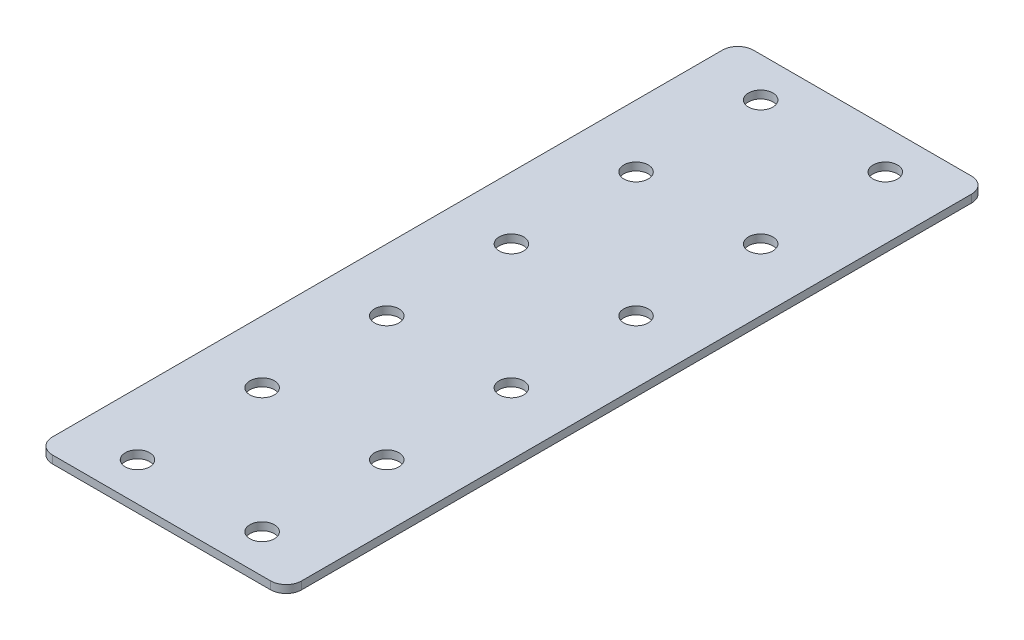
from build123d import *

# Parameters (mm, degrees)
SKETCH1_W           = 50.8
SKETCH1_H           = 142.875
SKETCH1_R           = 2.4892
BOSS_EXTRUDE1_DEPTH = 1.5875
FILLET1_R           = 3.175


with BuildPart() as part:
    # Sketch1 → Boss-Extrude1 (new body)
    with BuildSketch(Plane(origin=(0, 0, 0), x_dir=(1, 0, 0), z_dir=(0, 1, 0))):
        with Locations((25.4, 71.4375)):
            Rectangle(SKETCH1_W, SKETCH1_H)
        with Locations(Location((12.7, 7.813330322, 0), (0, 0, 270))):
            Circle(SKETCH1_R, mode=Mode.SUBTRACT)
        with Locations(Location((12.7, 33.213330322, 0), (0, 0, 270))):
            Circle(SKETCH1_R, mode=Mode.SUBTRACT)
        with Locations(Location((12.7, 58.613330322, 0), (0, 0, 270))):
            Circle(SKETCH1_R, mode=Mode.SUBTRACT)
        with Locations(Location((12.7, 84.013330322, 0), (0, 0, 270))):
            Circle(SKETCH1_R, mode=Mode.SUBTRACT)
        with Locations(Location((12.7, 109.413330322, 0), (0, 0, 270))):
            Circle(SKETCH1_R, mode=Mode.SUBTRACT)
        with Locations(Location((12.7, 134.813330322, 0), (0, 0, 270))):
            Circle(SKETCH1_R, mode=Mode.SUBTRACT)
        with Locations(Location((38.1, 33.213330322, 0), (0, 0, 270))):
            Circle(SKETCH1_R, mode=Mode.SUBTRACT)
        with Locations(Location((38.1, 58.613330322, 0), (0, 0, 270))):
            Circle(SKETCH1_R, mode=Mode.SUBTRACT)
        with Locations(Location((38.1, 84.013330322, 0), (0, 0, 270))):
            Circle(SKETCH1_R, mode=Mode.SUBTRACT)
        with Locations(Location((38.1, 109.413330322, 0), (0, 0, 270))):
            Circle(SKETCH1_R, mode=Mode.SUBTRACT)
        with Locations(Location((38.1, 134.813330322, 0), (0, 0, 270))):
            Circle(SKETCH1_R, mode=Mode.SUBTRACT)
        with Locations(Location((38.1, 7.813330322, 0), (0, 0, 270))):
            Circle(SKETCH1_R, mode=Mode.SUBTRACT)
    extrude(amount=BOSS_EXTRUDE1_DEPTH)

    # Fillet1
    fillet1_edges = [part.edges().sort_by_distance(p)[0] for p in [
        (0, 0.79375, -142.875),
        (50.8, 0.79375, -142.875),
        (50.8, 0.79375, 0),
        (0, 0.79375, 0),
    ]]
    fillet(fillet1_edges, radius=FILLET1_R)


solid = part.part
